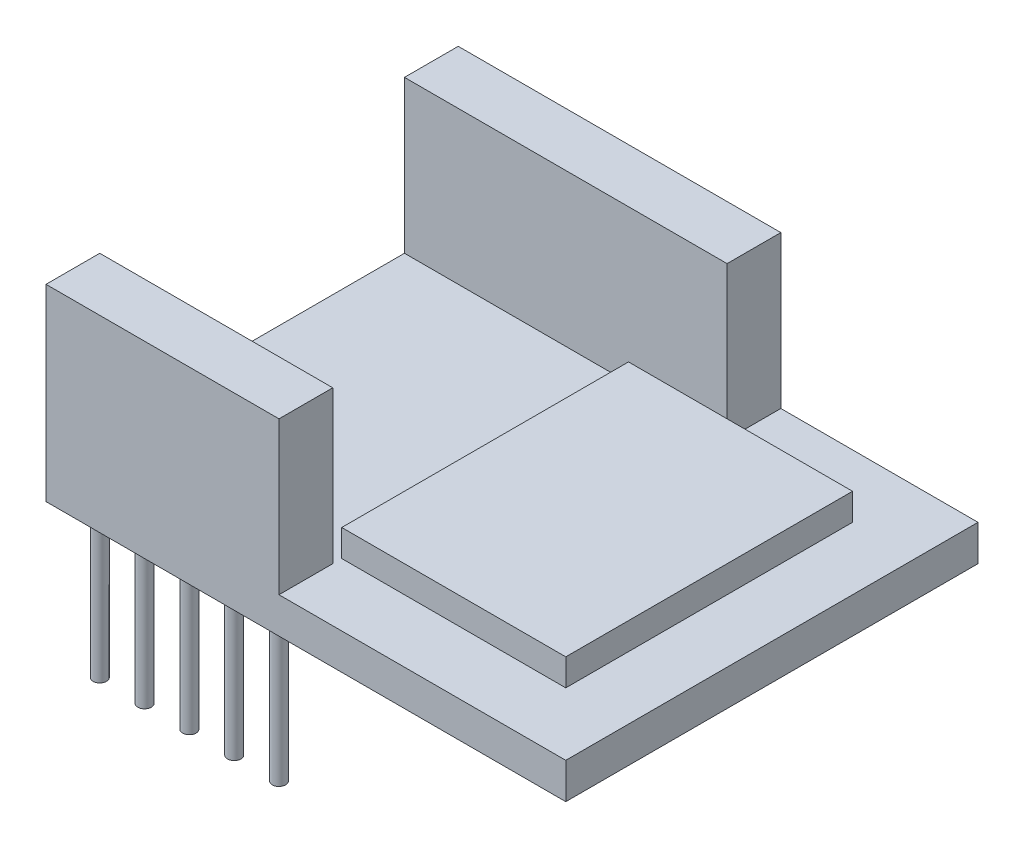
from build123d import *

# Parameters (mm, degrees)
SKETCH1_W           = 29
SKETCH1_H           = 23
BOSS_EXTRUDE1_DEPTH = 2
SKETCH2_W           = 13
SKETCH2_H           = 3
SKETCH2_W_2         = 18
BOSS_EXTRUDE2_DEPTH = 8.5
SKETCH3_R           = 0.375
BOSS_EXTRUDE3_DEPTH = 8.5
SKETCH5_W           = 12.5
SKETCH5_H           = 16
BOSS_EXTRUDE4_DEPTH = 1.5


with BuildPart() as part:
    # Sketch1 → Boss-Extrude1 (new body)
    with BuildSketch(Plane(origin=(0, 0, 0), x_dir=(1, 0, 0), z_dir=(0, 1, 0))):
        Rectangle(SKETCH1_W, SKETCH1_H)
    extrude(amount=BOSS_EXTRUDE1_DEPTH)

    # Sketch2 → Boss-Extrude2 (add)
    with BuildSketch(Plane(origin=(0, 2, 0), x_dir=(1, 0, 0), z_dir=(0, 1, 0))):
        with Locations((-8, -10)):
            Rectangle(SKETCH2_W, SKETCH2_H)
        with Locations((-5.5, 10)):
            Rectangle(SKETCH2_W_2, SKETCH2_H)
    extrude(amount=BOSS_EXTRUDE2_DEPTH)

    # Sketch3 → Boss-Extrude3 (add)
    with BuildSketch(Plane.XZ):
        with Locations(Location((2, -10, 0), (0, 0, 90))):
            Circle(SKETCH3_R)
        with Locations(Location((-0.5, -10, 0), (0, 0, 90))):
            Circle(SKETCH3_R)
        with Locations(Location((-3, -10, 0), (0, 0, 90))):
            Circle(SKETCH3_R)
        with Locations(Location((-5.5, -10, 0), (0, 0, 90))):
            Circle(SKETCH3_R)
        with Locations(Location((-8, -10, 0), (0, 0, 90))):
            Circle(SKETCH3_R)
        with Locations(Location((-3, 10, 0), (0, 0, 90))):
            Circle(SKETCH3_R)
        with Locations(Location((-5.5, 10, 0), (0, 0, 90))):
            Circle(SKETCH3_R)
        with Locations(Location((-8, 10, 0), (0, 0, 90))):
            Circle(SKETCH3_R)
        with Locations(Location((-10.5, 10, 0), (0, 0, 90))):
            Circle(SKETCH3_R)
        with Locations(Location((-13, 10, 0), (0, 0, 90))):
            Circle(SKETCH3_R)
        with Locations(Location((-10.5, -10, 0), (0, 0, 90))):
            Circle(SKETCH3_R)
        with Locations(Location((-13, -10, 0), (0, 0, 90))):
            Circle(SKETCH3_R)
    extrude(amount=BOSS_EXTRUDE3_DEPTH)

    # Sketch5 → Boss-Extrude4 (add)
    with BuildSketch(Plane(origin=(0, 2, 0), x_dir=(1, 0, 0), z_dir=(0, 1, 0))):
        with Locations((4.75, 0)):
            Rectangle(SKETCH5_W, SKETCH5_H)
    extrude(amount=BOSS_EXTRUDE4_DEPTH)


solid = part.part
